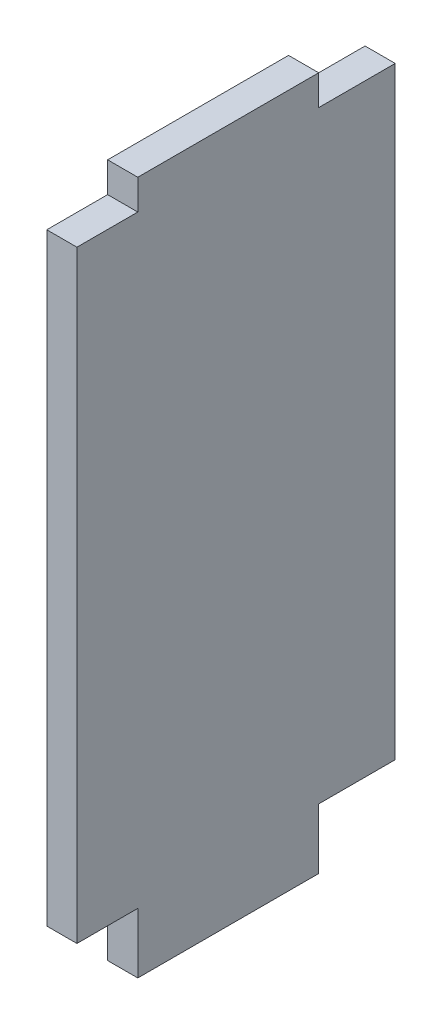
from build123d import *

# Parameters (mm, degrees)
BOSS_EXTRUDE1_DEPTH = 1.25


with BuildPart() as part:
    # Sketch1 → Boss-Extrude1 (new, symmetric)
    with BuildSketch(Plane(origin=(0, 0, 0), x_dir=(0, 0, -1), z_dir=(1, 0, 0))):
        Polygon((-13.195, -25), (-13.195, 25), (-8.14953567, 25), (-8.14953567, 27.5), (6.85046433, 27.5), (6.85046433, 25), (13.195, 25), (13.195, -25), (6.85046433, -25), (6.85046433, -30), (-8.14953567, -30), (-8.14953567, -25), align=None)
    extrude(amount=BOSS_EXTRUDE1_DEPTH, both=True)


solid = part.part
